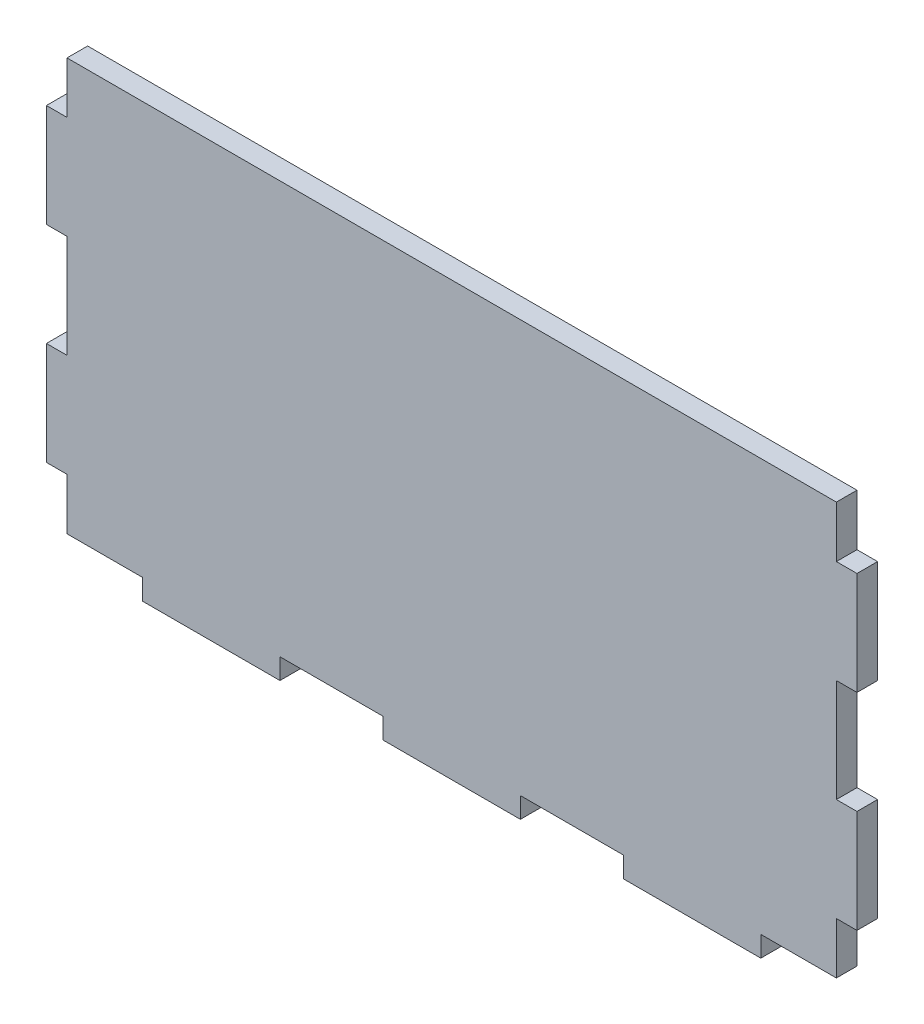
from build123d import *

# Parameters (mm, degrees)
SKETCH2_W           = 3
SKETCH2_H           = 15
SKETCH2_W_2         = 112
SKETCH2_H_2         = 60
SKETCH2_W_3         = 20
SKETCH2_H_3         = 3
BOSS_EXTRUDE1_DEPTH = 3


with BuildPart() as part:
    # Sketch2 → Boss-Extrude1 (new body)
    with BuildSketch(Plane.XY):
        with Locations((-57.5, 15)):
            Rectangle(SKETCH2_W, SKETCH2_H)
        with Locations((-57.5, -15)):
            Rectangle(SKETCH2_W, SKETCH2_H)
        Rectangle(SKETCH2_W_2, SKETCH2_H_2)
        with Locations((-35, -31.5)):
            Rectangle(SKETCH2_W_3, SKETCH2_H_3)
        with Locations((0, -31.5)):
            Rectangle(SKETCH2_W_3, SKETCH2_H_3)
        with Locations((35, -31.5)):
            Rectangle(SKETCH2_W_3, SKETCH2_H_3)
        with Locations((57.5, -15)):
            Rectangle(SKETCH2_W, SKETCH2_H)
        with Locations((57.5, 15)):
            Rectangle(SKETCH2_W, SKETCH2_H)
    extrude(amount=BOSS_EXTRUDE1_DEPTH)


solid = part.part
